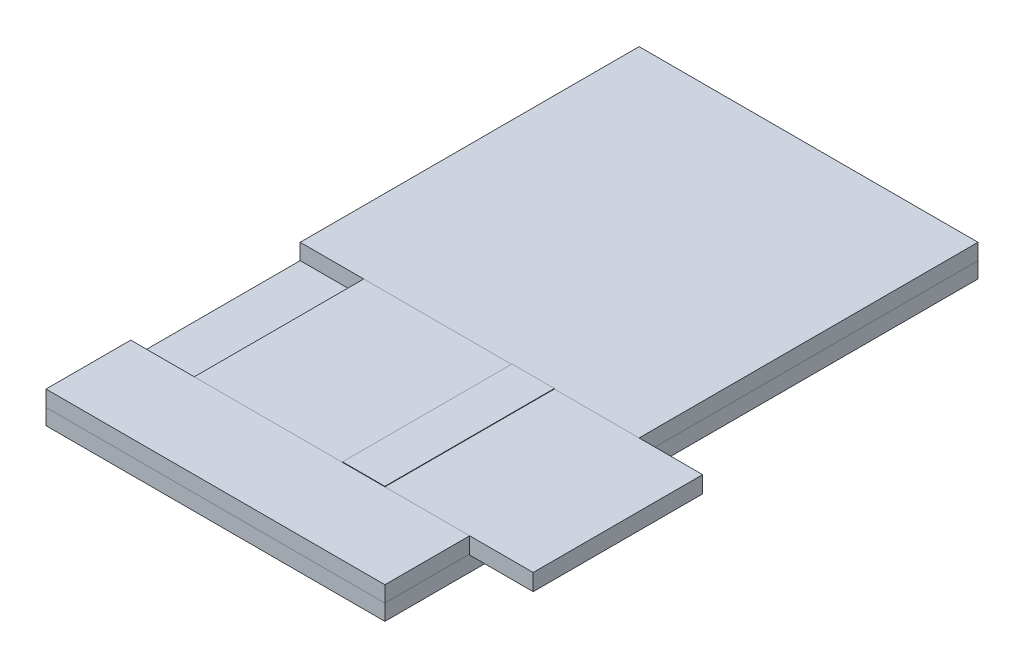
from build123d import *

# Parameters (mm, degrees)
BOSS_EXTRUDE1_DEPTH = 101.6
SKETCH1_3_W         = 203.2
SKETCH1_3_H         = 9.525
BOSS_EXTRUDE2_DEPTH = 101.6
SKETCH1_4_W         = 50.8
SKETCH1_4_H         = 9.525
BOSS_EXTRUDE3_DEPTH = 101.6
EXTRUDE_THIN1_START = 38.1
SKETCH1_5_W         = 101.6
SKETCH1_5_H         = 10
EXTRUDE_THIN1_DEPTH = 101.6
SKETCH2_W           = 25.4
SKETCH2_H           = 101.6
BOSS_EXTRUDE4_DEPTH = 0.3


with BuildPart() as part:
    # Sketch1 → Boss-Extrude1 (new, symmetric)
    with BuildSketch(Plane(origin=(0, 0, 0), x_dir=(0, 0, -1), z_dir=(1, 0, 0))):
        Polygon((-177.8, 9.525), (-177.8, 0), (177.8, 0), (177.8, 9.525), (-25.4, 9.525), (-127, 9.525), align=None)
    extrude(amount=BOSS_EXTRUDE1_DEPTH, both=True)


with BuildPart() as body_2:
    # Sketch1<3> → Boss-Extrude2 (new, symmetric)
    with BuildSketch(Plane(origin=(0, 0, 0), x_dir=(0, 0, -1), z_dir=(1, 0, 0))):
        with Locations((76.2, 14.2875)):
            Rectangle(SKETCH1_3_W, SKETCH1_3_H)
    extrude(amount=BOSS_EXTRUDE2_DEPTH, both=True)


with BuildPart() as body_3:
    # Sketch1<4> → Boss-Extrude3 (new, symmetric)
    with BuildSketch(Plane(origin=(0, 0, 0), x_dir=(0, 0, -1), z_dir=(1, 0, 0))):
        with Locations((-152.4, 14.2875)):
            Rectangle(SKETCH1_4_W, SKETCH1_4_H)
    extrude(amount=BOSS_EXTRUDE3_DEPTH, both=True)


with BuildPart() as body_4:
    # Sketch1<5> → Extrude-Thin1 (new, symmetric)
    with BuildSketch(Plane(origin=(0, 0, 0), x_dir=(0, 0, -1), z_dir=(1, 0, 0)).offset(EXTRUDE_THIN1_START)):
        with Locations((-76.2, 14.05)):
            Rectangle(SKETCH1_5_W, SKETCH1_5_H)
    extrude(amount=EXTRUDE_THIN1_DEPTH, both=True)


with BuildPart() as body_5:
    # Sketch2 → Boss-Extrude4 (new body)
    with BuildSketch(Plane(origin=(0, 19.05, 0), x_dir=(1, 0, 0), z_dir=(0, 1, 0))):
        with Locations((38.1, -76.2)):
            Rectangle(SKETCH2_W, SKETCH2_H)
    extrude(amount=BOSS_EXTRUDE4_DEPTH)


solid = Compound([part.part, body_2.part, body_3.part, body_4.part, body_5.part])
